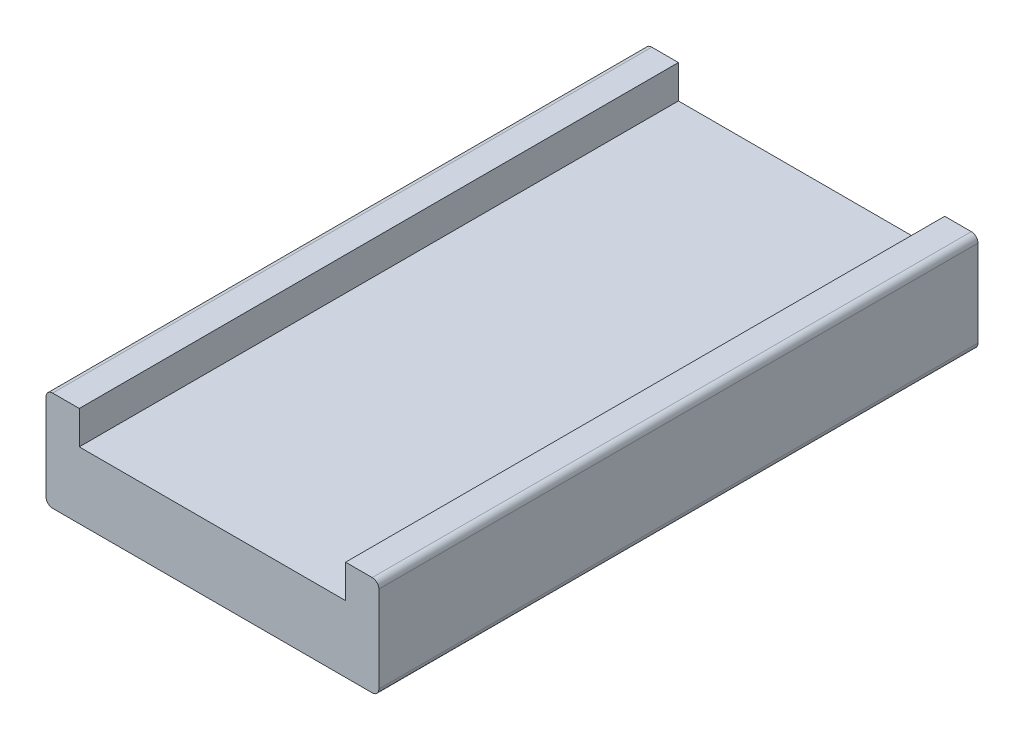
from build123d import *

# Parameters (mm, degrees)
BOSS_EXTRUDE1_DEPTH = 90
FILLET1_R           = 1


with BuildPart() as part:
    # Sketch1 → Boss-Extrude1 (new body)
    with BuildSketch(Plane.XY):
        Polygon((-25, 0), (25, 0), (25, 15), (20, 15), (20, 10), (-20, 10), (-20, 15), (-25, 15), align=None)
    extrude(amount=BOSS_EXTRUDE1_DEPTH)

    # Fillet1
    fillet1_edges = [part.edges().sort_by_distance(p)[0] for p in [
        (-25, 15, 45),
        (25, 15, 45),
        (25, 0, 45),
        (-25, 0, 45),
    ]]
    fillet(fillet1_edges, radius=FILLET1_R)


solid = part.part
